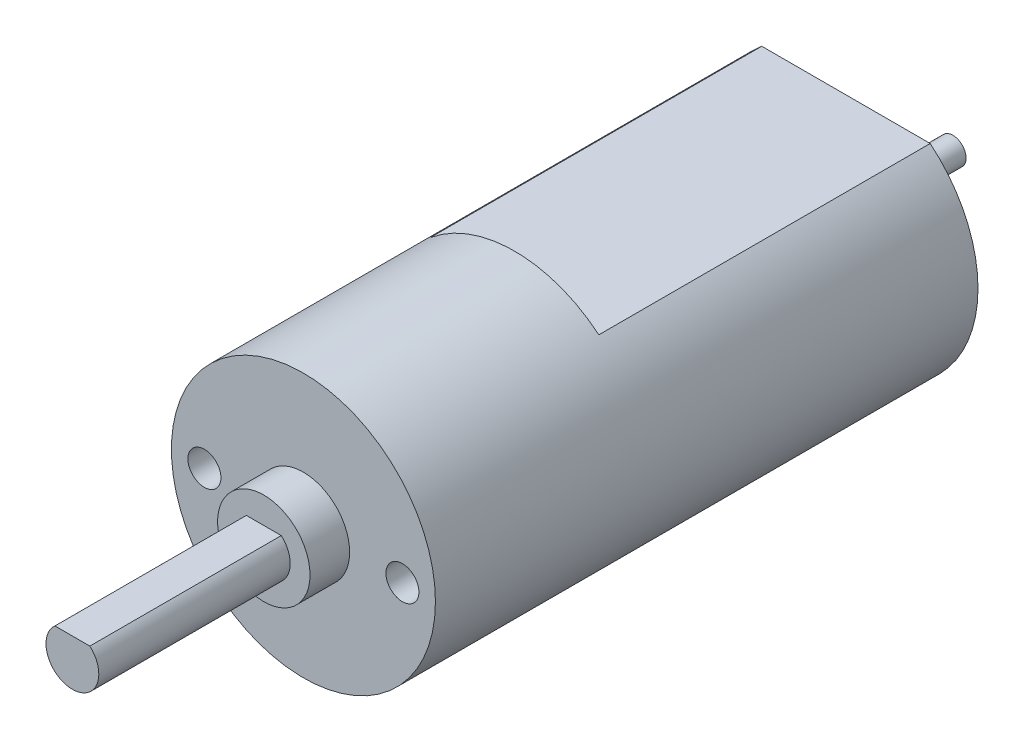
from build123d import *

# Parameters (mm, degrees)
SKETCH1_R               = 10
BOSS_EXTRUDE1_DEPTH     = 41.1
SKETCH2_W               = 25.1
SKETCH2_H               = 2.3
CUT_EXTRUDE1_DEPTH      = 44.465043426
SKETCH3_R               = 3.5
BOSS_EXTRUDE2_DEPTH     = 3
SKETCH5_R               = 2
BOSS_EXTRUDE4_DEPTH     = 14.5
CUT_EXTRUDE2_DEPTH      = 44.465043426
CUT_EXTRUDE2_DEPTH_BACK = 44.465043426
SKETCH6_W               = 14.5
SKETCH6_H               = 0.5
SKETCH7_R               = 3.1
BOSS_EXTRUDE5_DEPTH     = 2.1
SKETCH8_R               = 1
BOSS_EXTRUDE6_DEPTH     = 6
SKETCH10_R              = 1.25
CUT_EXTRUDE3_DEPTH      = 15


with BuildPart() as part:
    # Sketch1 → Boss-Extrude1 (new body)
    with BuildSketch(Plane.XY):
        Circle(SKETCH1_R)
    extrude(amount=-BOSS_EXTRUDE1_DEPTH)

    # Sketch2 → Cut-Extrude1 (cut, symmetric)
    with BuildSketch(Plane(origin=(0, 0, 0), x_dir=(0, 0, -1), z_dir=(1, 0, 0))):
        with Locations((28.55, 8.85)):
            Rectangle(SKETCH2_W, SKETCH2_H)
    cut_extrude1 = extrude(amount=CUT_EXTRUDE1_DEPTH, both=True, mode=Mode.SUBTRACT)

    # Mirror1: Cut-Extrude1 across plane
    add(cut_extrude1.mirror(Plane.ZX), mode=Mode.SUBTRACT)

    # Sketch3 → Boss-Extrude2 (add)
    with BuildSketch(Plane.XY):
        Circle(SKETCH3_R)
    extrude(amount=BOSS_EXTRUDE2_DEPTH)

    # Sketch5 → Boss-Extrude4 (add)
    with BuildSketch(Plane.XY.offset(3)):
        with Locations(Location((0, 0, 0), (0, 0, 180))):
            Circle(SKETCH5_R)
    extrude(amount=BOSS_EXTRUDE4_DEPTH)

    # Sketch6 → Cut-Extrude2 (cut, two sides: drawn at the far end of the back side and taken through both)
    with BuildSketch(Plane(origin=(0, 0, 0), x_dir=(0, 0, -1), z_dir=(1, 0, 0)).offset(-CUT_EXTRUDE2_DEPTH_BACK)):
        with Locations((-10.25, 1.75)):
            Rectangle(SKETCH6_W, SKETCH6_H)
    extrude(amount=CUT_EXTRUDE2_DEPTH + CUT_EXTRUDE2_DEPTH_BACK, mode=Mode.SUBTRACT)

    # Sketch7 → Boss-Extrude5 (add)
    with BuildSketch(Plane(origin=(0, 0, -41.1), x_dir=(-1, 0, 0), z_dir=(0, 0, -1))):
        Circle(SKETCH7_R)
    extrude(amount=BOSS_EXTRUDE5_DEPTH)

    # Sketch8 → Boss-Extrude6 (add)
    with BuildSketch(Plane(origin=(0, 0, -43.2), x_dir=(-1, 0, 0), z_dir=(0, 0, -1))):
        Circle(SKETCH8_R)
    extrude(amount=BOSS_EXTRUDE6_DEPTH)

    # Sketch10 → Cut-Extrude3 (cut)
    with BuildSketch(Plane.XY):
        with Locations((-7.5, 0)):
            Circle(SKETCH10_R)
    cut_extrude3 = extrude(amount=-CUT_EXTRUDE3_DEPTH, mode=Mode.SUBTRACT)

    # Mirror2: Cut-Extrude3 across plane
    add(cut_extrude3.mirror(Plane(origin=(0, 0, 0), x_dir=(0, 0, 1), z_dir=(1, 0, 0))), mode=Mode.SUBTRACT)


solid = part.part
